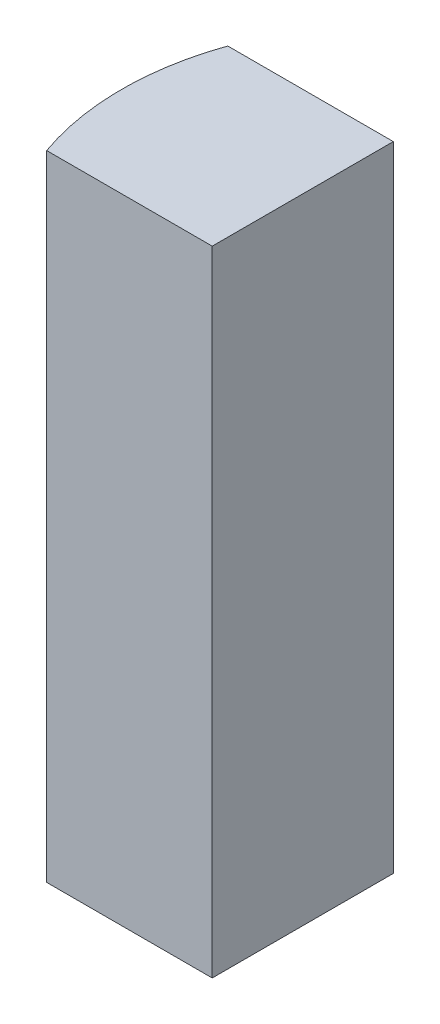
from build123d import *

# Parameters (mm, degrees)
EXTRUDE_1_DEPTH = 140


with BuildPart() as part:
    # 草图1 → 凸台-拉伸1 (new body)
    with BuildSketch(Plane(origin=(0, 0, 0), x_dir=(1, 0, 0), z_dir=(0, 1, 0))):
        with BuildLine():
            ThreePointArc((-56.568542495, 20), (-60, 0), (-56.568542495, -20))
            Line((-56.568542495, -20), (-20, -20))
            Line((-20, -20), (-20, 20))
            Line((-20, 20), (-56.568542495, 20))
        make_face()
    extrude(amount=EXTRUDE_1_DEPTH)


solid = part.part
